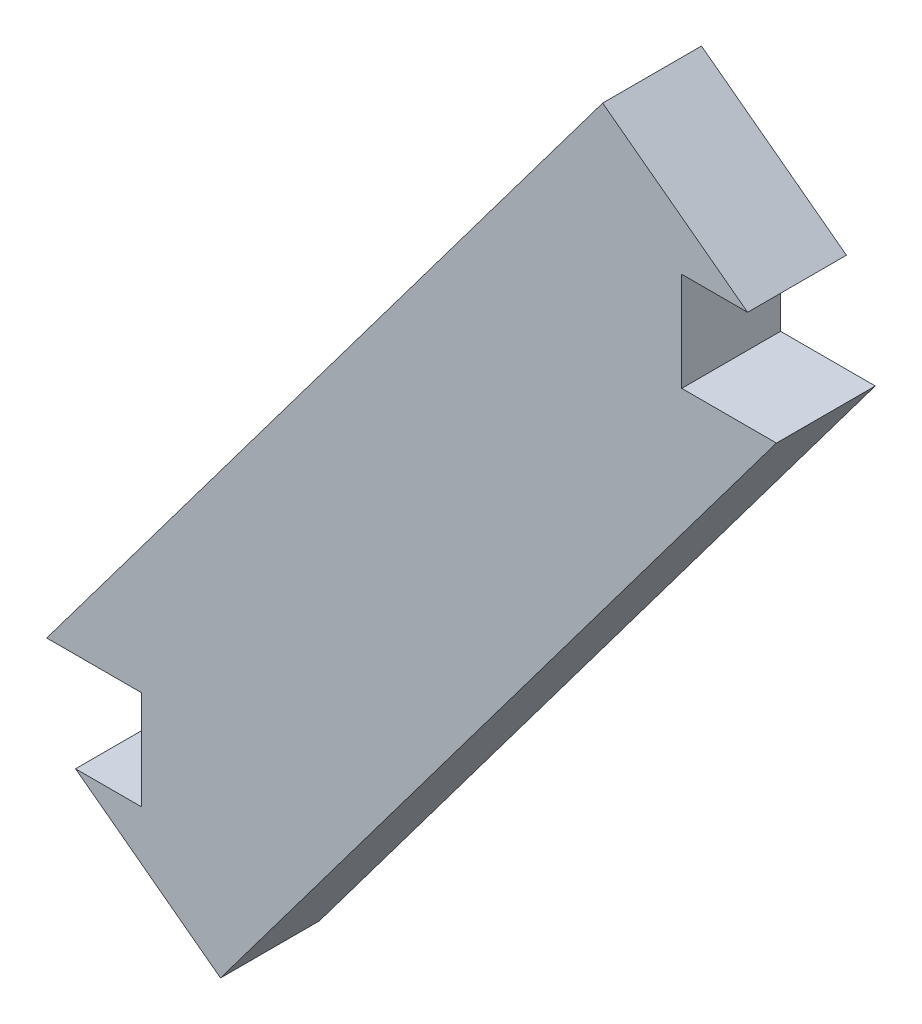
from build123d import *

# Parameters (mm, degrees)
BOSS_EXTRUDE1_DEPTH = 4.7625


with BuildPart() as part:
    # Sketch1 → Boss-Extrude1 (new body)
    with BuildSketch(Plane.XY):
        Polygon((28.575, 38.1), (1.7859375, 2.38125), (6.35, 2.38125), (6.35, -2.38125), (3.175, -2.38125), (10.16, -7.62), (36.9490625, 28.09875), (32.385, 28.09875), (32.385, 32.86125), (35.56, 32.86125), align=None)
    extrude(amount=BOSS_EXTRUDE1_DEPTH)


solid = part.part
